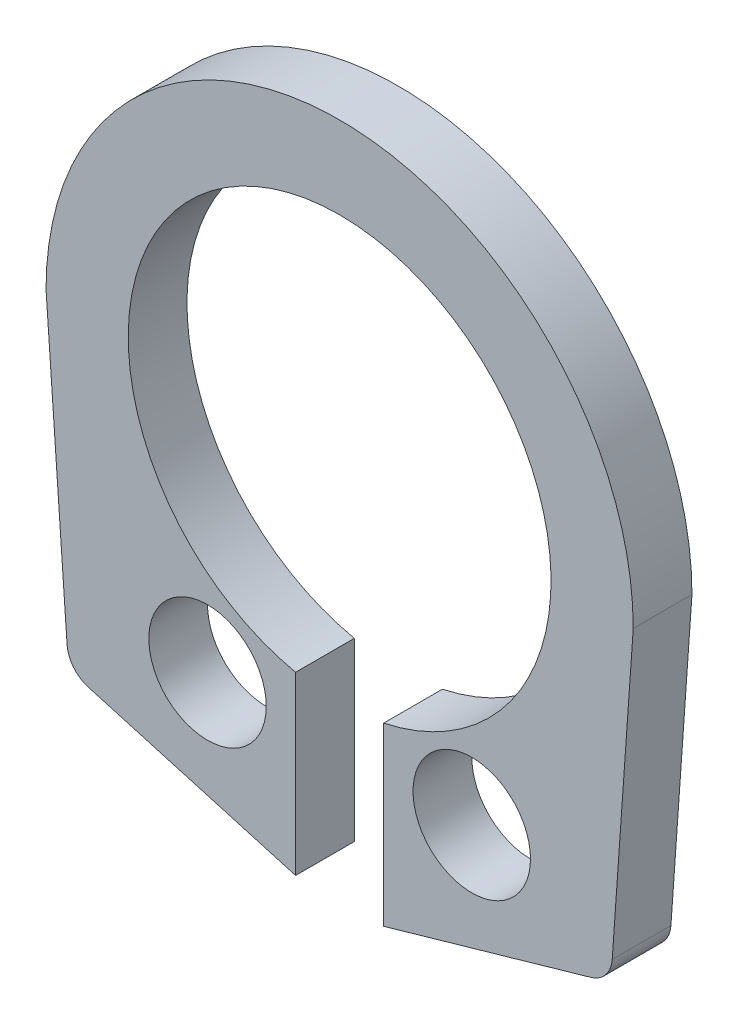
from build123d import *

# Parameters (mm, degrees)
SKETCH_1_R      = 1
EXTRUDE_1_DEPTH = 1
FILLET_1_R      = 0.5


with BuildPart() as part:
    # 草图1 → 凸台-拉伸1 (new body)
    with BuildSketch(Plane.XY):
        with BuildLine():
            Line((-0.75, -7.095841887), (-0.75, -6.711388546))
            Line((-0.75, -6.711388546), (-0.75, -5.520914569))
            Line((-0.75, -5.520914569), (-0.75, -4.098492964))
            ThreePointArc((-0.75, -4.098492964), (-2.264950331, 2.22072913), (3.6, -0.577484586))
            ThreePointArc((3.6, -0.577484586), (2.798213716, -2.842434917), (0.75, -4.098492964))
            Line((0.75, -4.098492964), (0.75, -5.520914569))
            Line((0.75, -5.520914569), (0.75, -6.711388546))
            Line((0.75, -6.711388546), (0.75, -7.095841887))
            Line((0.75, -7.095841887), (4.616918769, -5.987758242))
            Line((4.616918769, -5.987758242), (5, -0.577484586))
            ThreePointArc((5, -0.577484586), (0, 4.422515414), (-5, -0.577484586))
            Line((-5, -0.577484586), (-4.616918769, -5.987758242))
            Line((-4.616918769, -5.987758242), (-0.75, -7.095841887))
        make_face()
        with Locations((-2.25, -4.852026876)):
            Circle(SKETCH_1_R, mode=Mode.SUBTRACT)
        with Locations((2.25, -4.852026876)):
            Circle(SKETCH_1_R, mode=Mode.SUBTRACT)
    extrude(amount=EXTRUDE_1_DEPTH)

    # 圆角1
    fillet_1_edges = [part.edges().sort_by_distance(p)[0] for p in [
        (4.616918769, -5.987758242, 0.5),
        (-4.616918769, -5.987758242, 0.5),
    ]]
    fillet(fillet_1_edges, radius=FILLET_1_R)


solid = part.part
